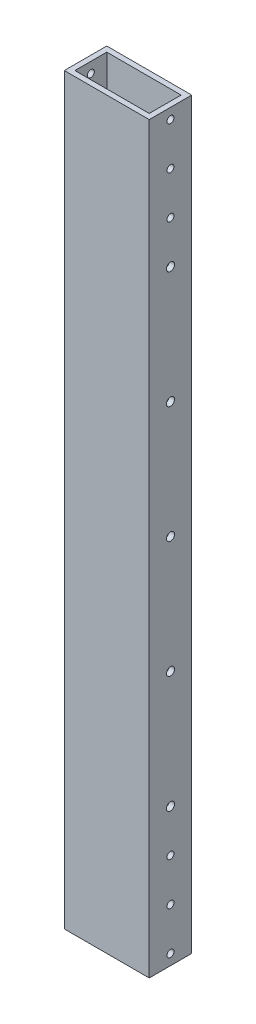
from build123d import *

# Parameters (mm, degrees)
SKETCH1_W           = 50.8
SKETCH1_H           = 25.4
SKETCH1_W_2         = 44.45
SKETCH1_H_2         = 19.05
BOSS_EXTRUDE1_DEPTH = 444.5
CUT_EXTRUDE1_REACH  = 412.536
SKETCH2_R           = 2.0828
SKETCH3_R           = 2.4257
CUT_EXTRUDE2_DEPTH  = 3.175


with BuildPart() as part:
    # Sketch1 → Boss-Extrude1 (new body)
    with BuildSketch(Plane(origin=(0, 0, 0), x_dir=(1, 0, 0), z_dir=(0, 1, 0))):
        with Locations((25.4, 12.7)):
            Rectangle(SKETCH1_W, SKETCH1_H)
        with Locations((25.4, 12.7)):
            Rectangle(SKETCH1_W_2, SKETCH1_H_2, mode=Mode.SUBTRACT)
    extrude(amount=BOSS_EXTRUDE1_DEPTH)

    # Cut-Extrude1: up to this face of the body (flat: up to its plane)
    cut_extrude1_end = Plane(part.part.faces().sort_by_distance((0, 222.25, -12.7))[0])
    # Sketch2 → Cut-Extrude1 (cut, up to the picked face)
    with BuildSketch(Plane(origin=(50.8, 398.917681448, 57.205629331), x_dir=(0, 0, 1), z_dir=(1, 0, 0)), mode=Mode.PRIVATE) as cut_extrude1_sk1:
        with Locations(Location((-69.905629331, -39.232318552, 0), (0, 0, 180))):
            Circle(SKETCH2_R)
    cut_extrude1_tool1 = split(extrude(cut_extrude1_sk1.sketch, amount=-CUT_EXTRUDE1_REACH, mode=Mode.PRIVATE), bisect_by=cut_extrude1_end, keep=Keep.BOTH, mode=Mode.PRIVATE)
    # Sketch2 → Cut-Extrude1 (cut, up to the picked face)
    with BuildSketch(Plane(origin=(50.8, 398.917681448, 57.205629331), x_dir=(0, 0, 1), z_dir=(1, 0, 0)), mode=Mode.PRIVATE) as cut_extrude1_sk2:
        with Locations(Location((-69.905629331, -13.832318552, 0), (0, 0, 180))):
            Circle(SKETCH2_R)
    cut_extrude1_tool2 = split(extrude(cut_extrude1_sk2.sketch, amount=-CUT_EXTRUDE1_REACH, mode=Mode.PRIVATE), bisect_by=cut_extrude1_end, keep=Keep.BOTH, mode=Mode.PRIVATE)
    # Sketch2 → Cut-Extrude1 (cut, up to the picked face)
    with BuildSketch(Plane(origin=(50.8, 398.917681448, 57.205629331), x_dir=(0, 0, 1), z_dir=(1, 0, 0)), mode=Mode.PRIVATE) as cut_extrude1_sk3:
        with Locations(Location((-69.905629331, 11.567681448, 0), (0, 0, 180))):
            Circle(SKETCH2_R)
    cut_extrude1_tool3 = split(extrude(cut_extrude1_sk3.sketch, amount=-CUT_EXTRUDE1_REACH, mode=Mode.PRIVATE), bisect_by=cut_extrude1_end, keep=Keep.BOTH, mode=Mode.PRIVATE)
    # Sketch2 → Cut-Extrude1 (cut, up to the picked face)
    with BuildSketch(Plane(origin=(50.8, 398.917681448, 57.205629331), x_dir=(0, 0, 1), z_dir=(1, 0, 0)), mode=Mode.PRIVATE) as cut_extrude1_sk4:
        with Locations(Location((-69.905629331, 341.767681448, 0), (0, 0, 180))):
            Circle(SKETCH2_R)
    cut_extrude1_tool4 = split(extrude(cut_extrude1_sk4.sketch, amount=-CUT_EXTRUDE1_REACH, mode=Mode.PRIVATE), bisect_by=cut_extrude1_end, keep=Keep.BOTH, mode=Mode.PRIVATE)
    # Sketch2 → Cut-Extrude1 (cut, up to the picked face)
    with BuildSketch(Plane(origin=(50.8, 398.917681448, 57.205629331), x_dir=(0, 0, 1), z_dir=(1, 0, 0)), mode=Mode.PRIVATE) as cut_extrude1_sk5:
        with Locations(Location((-69.905629331, 367.167681448, 0), (0, 0, 180))):
            Circle(SKETCH2_R)
    cut_extrude1_tool5 = split(extrude(cut_extrude1_sk5.sketch, amount=-CUT_EXTRUDE1_REACH, mode=Mode.PRIVATE), bisect_by=cut_extrude1_end, keep=Keep.BOTH, mode=Mode.PRIVATE)
    # Sketch2 → Cut-Extrude1 (cut, up to the picked face)
    with BuildSketch(Plane(origin=(50.8, 398.917681448, 57.205629331), x_dir=(0, 0, 1), z_dir=(1, 0, 0)), mode=Mode.PRIVATE) as cut_extrude1_sk6:
        with Locations(Location((-69.905629331, 392.567681448, 0), (0, 0, 180))):
            Circle(SKETCH2_R)
    cut_extrude1_tool6 = split(extrude(cut_extrude1_sk6.sketch, amount=-CUT_EXTRUDE1_REACH, mode=Mode.PRIVATE), bisect_by=cut_extrude1_end, keep=Keep.BOTH, mode=Mode.PRIVATE)
    add(cut_extrude1_tool1.solids().sort_by(Axis((50.8, 438.15, -12.7), (-1, 0, 0)))[0], mode=Mode.SUBTRACT)
    add(cut_extrude1_tool2.solids().sort_by(Axis((50.8, 412.75, -12.7), (-1, 0, 0)))[0], mode=Mode.SUBTRACT)
    add(cut_extrude1_tool3.solids().sort_by(Axis((50.8, 387.35, -12.7), (-1, 0, 0)))[0], mode=Mode.SUBTRACT)
    add(cut_extrude1_tool4.solids().sort_by(Axis((50.8, 57.15, -12.7), (-1, 0, 0)))[0], mode=Mode.SUBTRACT)
    add(cut_extrude1_tool5.solids().sort_by(Axis((50.8, 31.75, -12.7), (-1, 0, 0)))[0], mode=Mode.SUBTRACT)
    add(cut_extrude1_tool6.solids().sort_by(Axis((50.8, 6.35, -12.7), (-1, 0, 0)))[0], mode=Mode.SUBTRACT)

    # Sketch3 → Cut-Extrude2 (cut)
    with BuildSketch(Plane(origin=(50.8, 398.917681448, 57.205629331), x_dir=(0, 0, 1), z_dir=(1, 0, 0))):
        with Locations(Location((-69.905629331, 36.967681448, 0), (0, 0, 180))):
            Circle(SKETCH3_R)
        with Locations(Location((-69.905629331, 106.817681448, 0), (0, 0, 180))):
            Circle(SKETCH3_R)
        with Locations(Location((-69.905629331, 176.667681448, 0), (0, 0, 180))):
            Circle(SKETCH3_R)
        with Locations(Location((-69.905629331, 246.517681448, 0), (0, 0, 180))):
            Circle(SKETCH3_R)
        with Locations(Location((-69.905629331, 316.367681448, 0), (0, 0, 180))):
            Circle(SKETCH3_R)
    extrude(amount=-CUT_EXTRUDE2_DEPTH, mode=Mode.SUBTRACT)


solid = part.part
